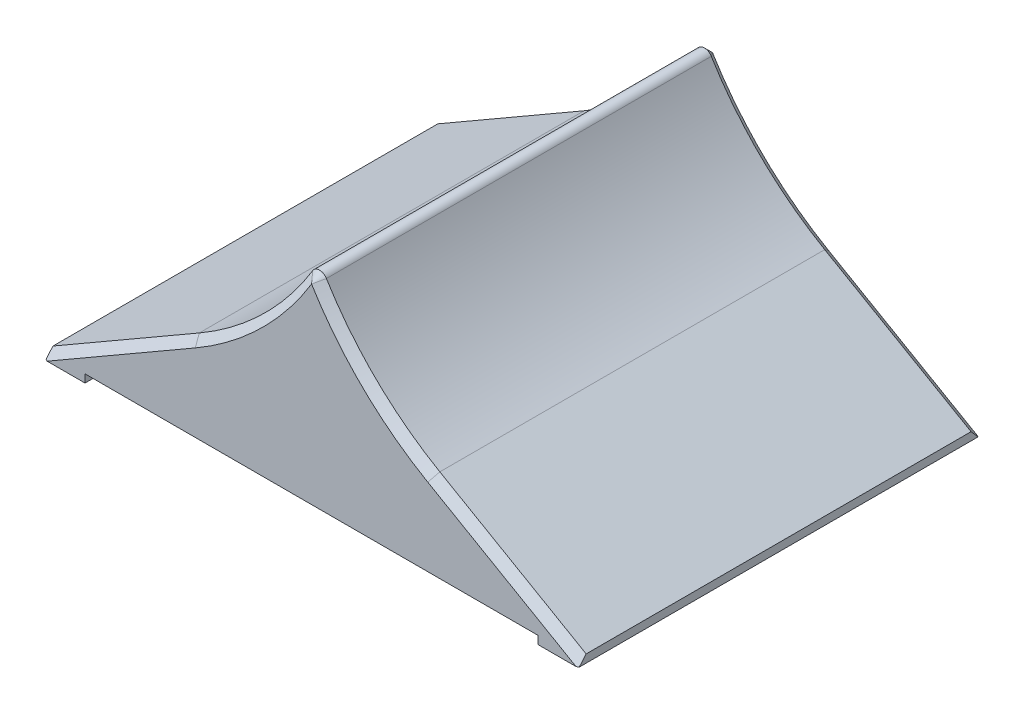
from build123d import *

# Parameters (mm, degrees)
BOSS_EXTRUDE1_DEPTH   = 1
BOSS_EXTRUDE1_2_DEPTH = 1
BOSS_EXTRUDE2_DEPTH   = 50
CHAMFER1_SIZE         = 1


with BuildPart() as part:
    # Sketch1 → Boss-Extrude1 (new body)
    with BuildSketch(Plane(origin=(0, 0, 0), x_dir=(1, 0, 0), z_dir=(0, 1, 0))):
        Polygon((-28.25, 25), (-28.25, 15), (-31.25, 12), (-31.25, -12), (-28.25, -15), (-28.25, -25), (-33.25, -25), (-33.25, 25), align=None)
    extrude(amount=BOSS_EXTRUDE1_DEPTH)



with BuildPart() as body_2:
    # Sketch1 → Boss-Extrude1 2 (new body)
    with BuildSketch(Plane(origin=(0, 0, 0), x_dir=(1, 0, 0), z_dir=(0, 1, 0))):
        Polygon((33.25, 25), (28.25, 25), (28.25, 15), (31.25, 12), (31.25, -12), (28.25, -15), (28.25, -25), (33.25, -25), align=None)
    extrude(amount=BOSS_EXTRUDE1_2_DEPTH)


with BuildPart() as part_1:
    add(part.part)

    add(body_2.part)  # Boss-Extrude2 merges body 2
    # Sketch2 → Boss-Extrude2 (add)
    with BuildSketch(Plane.XY.offset(25)):
        with BuildLine():
            Line((-33.25, 1), (33.25, 1))
            Line((33.25, 1), (15, 11.536642413))
            ThreePointArc((15, 11.536642413), (7.060428276, 17.552838357), (0.853658537, 25.344335145))
            ThreePointArc((0.853658537, 25.344335145), (0, 25.82350206), (-0.853658537, 25.344335145))
            ThreePointArc((-0.853658537, 25.344335145), (-7.060428276, 17.552838357), (-15, 11.536642413))
            Line((-15, 11.536642413), (-33.25, 1))
        make_face()
    extrude(amount=-BOSS_EXTRUDE2_DEPTH)

    # Chamfer1
    chamfer1_edges = [part_1.edges().sort_by_distance(p)[0] for p in [
        (24.125, 6.268321206, -25),
        (24.125, 6.268321206, 25),
        (7.060428276, 17.552838357, -25),
        (7.060428276, 17.552838357, 25),
        (0, 25.82350206, -25),
        (0, 25.82350206, 25),
        (-24.125, 6.268321206, -25),
        (-24.125, 6.268321206, 25),
        (-7.060428276, 17.552838357, -25),
        (-7.060428276, 17.552838357, 25),
    ]]
    chamfer(chamfer1_edges, length=CHAMFER1_SIZE)


solid = part_1.part
